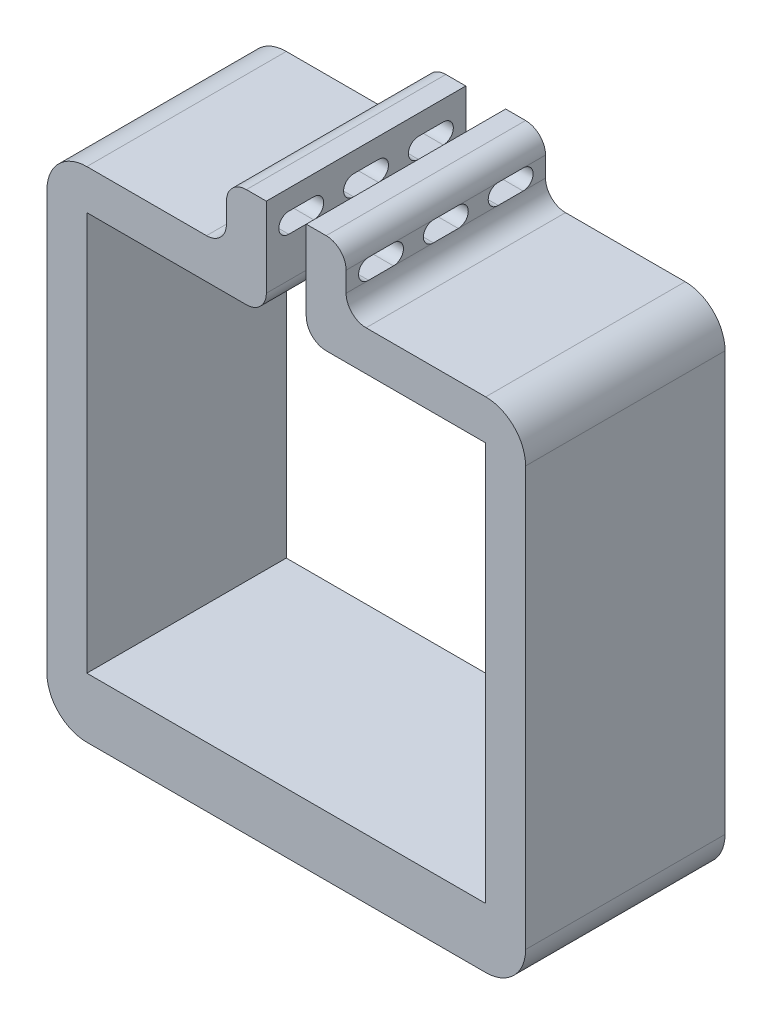
from build123d import *

# Parameters (mm, degrees)
SKETCH1_W           = 50.8
SKETCH1_H           = 50.8
BOSS_EXTRUDE1_DEPTH = 25.4
SKETCH2_W           = 5.08
SKETCH2_H           = 5.08
CUT_EXTRUDE1_DEPTH  = 84.007883963
FILLET1_R           = 2.54
SKETCH3_W           = 5.08
SKETCH3_H           = 7.62
BOSS_EXTRUDE2_DEPTH = 25.4
FILLET2_R           = 2.54
CUT_EXTRUDE2_DEPTH  = 79.288057838


with BuildPart() as part:
    # Sketch1 → Boss-Extrude1 (new body)
    with BuildSketch(Plane.XY):
        with BuildLine():
            Line((0, 55.88), (50.8, 55.88))
            ThreePointArc((50.8, 55.88), (54.392102448, 54.392102448), (55.88, 50.8))
            Line((55.88, 50.8), (55.88, -2.54))
            ThreePointArc((55.88, -2.54), (54.392102448, -6.132102448), (50.8, -7.62))
            Line((50.8, -7.62), (0, -7.62))
            ThreePointArc((0, -7.62), (-3.592102448, -6.132102448), (-5.08, -2.54))
            Line((-5.08, -2.54), (-5.08, 50.8))
            ThreePointArc((-5.08, 50.8), (-3.592102448, 54.392102448), (0, 55.88))
        make_face()
        with Locations((25.4, 25.4)):
            Rectangle(SKETCH1_W, SKETCH1_H, mode=Mode.SUBTRACT)
    extrude(amount=BOSS_EXTRUDE1_DEPTH)

    # Sketch2 → Cut-Extrude1 (cut, through all)
    with BuildSketch(Plane.XY.offset(25.4)):
        with Locations((25.4, 53.34)):
            Rectangle(SKETCH2_W, SKETCH2_H)
    extrude(amount=-CUT_EXTRUDE1_DEPTH, mode=Mode.SUBTRACT)

    # Fillet1
    fillet1_edges = [part.edges().sort_by_distance(p)[0] for p in [
        (22.86, 50.8, 12.7),
        (27.94, 50.8, 12.7),
    ]]
    fillet(fillet1_edges, radius=FILLET1_R)

    # Sketch3 → Boss-Extrude2 (add)
    with BuildSketch(Plane.XY.offset(25.4)):
        with Locations((20.32, 59.69)):
            Rectangle(SKETCH3_W, SKETCH3_H)
        with Locations((30.48, 59.69)):
            Rectangle(SKETCH3_W, SKETCH3_H)
    extrude(amount=-BOSS_EXTRUDE2_DEPTH)

    # Fillet2
    fillet2_edges = [part.edges().sort_by_distance(p)[0] for p in [
        (17.78, 55.88, 12.7),
        (17.78, 63.5, 12.7),
        (33.02, 63.5, 12.7),
        (33.02, 55.88, 12.7),
    ]]
    fillet(fillet2_edges, radius=FILLET2_R)

    # Sketch4 → Cut-Extrude2 (cut, through all)
    with BuildSketch(Plane.ZY.offset(-17.78)):
        with BuildLine():
            Line((2.8575, 60.96), (6.0325, 60.96))
            ThreePointArc((6.0325, 60.96), (7.3025, 59.69), (6.0325, 58.42))
            Line((6.0325, 58.42), (2.8575, 58.42))
            ThreePointArc((2.8575, 58.42), (1.5875, 59.69), (2.8575, 60.96))
        make_face()
        with BuildLine():
            Line((11.1125, 60.96), (14.2875, 60.96))
            ThreePointArc((14.2875, 60.96), (15.5575, 59.69), (14.2875, 58.42))
            Line((14.2875, 58.42), (11.1125, 58.42))
            ThreePointArc((11.1125, 58.42), (9.8425, 59.69), (11.1125, 60.96))
        make_face()
        with BuildLine():
            Line((19.3675, 60.96), (22.5425, 60.96))
            ThreePointArc((22.5425, 60.96), (23.8125, 59.69), (22.5425, 58.42))
            Line((22.5425, 58.42), (19.3675, 58.42))
            ThreePointArc((19.3675, 58.42), (18.0975, 59.69), (19.3675, 60.96))
        make_face()
    extrude(amount=-CUT_EXTRUDE2_DEPTH, mode=Mode.SUBTRACT)


solid = part.part
